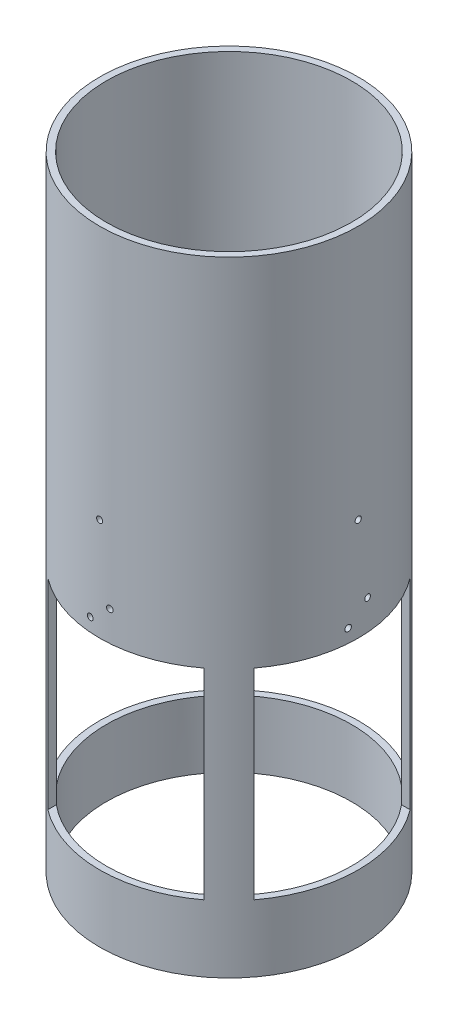
from build123d import *

# Parameters (mm, degrees)
SKETCH1_R           = 73.66
SKETCH1_R_2         = 69.85
BOSS_EXTRUDE1_DEPTH = 355.6
SKETCH4_W           = 88.9
SKETCH4_H           = 114.3
CUT_EXTRUDE1_DEPTH  = 76.2
CIRPATTERN1_COUNT   = 4
SKETCH5_R           = 1.7526
CUT_EXTRUDE2_DEPTH  = 76.2
CIRPATTERN2_COUNT   = 4


with BuildPart() as part:
    # Sketch1 → Boss-Extrude1 (new body)
    with BuildSketch(Plane(origin=(0, 0, 0), x_dir=(1, 0, 0), z_dir=(0, 1, 0))):
        with Locations(Location((0, 0, 0), (0, 0, 270))):
            Circle(SKETCH1_R)
        with Locations(Location((0, 0, 0), (0, 0, 270))):
            Circle(SKETCH1_R_2, mode=Mode.SUBTRACT)
    extrude(amount=BOSS_EXTRUDE1_DEPTH)

    # Sketch4 → Cut-Extrude1 (cut)
    with BuildSketch(Plane(origin=(73.66, 0, 0), x_dir=(0, 0, -1), z_dir=(1, 0, 0))):
        with Locations((0, 95.25)):
            Rectangle(SKETCH4_W, SKETCH4_H)
    cut_extrude1 = extrude(amount=-CUT_EXTRUDE1_DEPTH, mode=Mode.SUBTRACT)

    # CirPattern1: Cut-Extrude1 ×4 about axis
    cirpattern1_axis = Axis((0, 0, 0), (0, 1, 0))
    for i in range(1, CIRPATTERN1_COUNT):
        add(cut_extrude1.rotate(cirpattern1_axis, i * 360 / CIRPATTERN1_COUNT), mode=Mode.SUBTRACT)

    # Sketch5 → Cut-Extrude2 (cut)
    with BuildSketch(Plane(origin=(73.66, 0, 0), x_dir=(0, 0, -1), z_dir=(1, 0, 0))):
        with Locations((0, 210.82)):
            Circle(SKETCH5_R)
        with Locations((5.55625, 169.545)):
            Circle(SKETCH5_R)
        with Locations((-5.55625, 160.02)):
            Circle(SKETCH5_R)
    cut_extrude2 = extrude(amount=-CUT_EXTRUDE2_DEPTH, mode=Mode.SUBTRACT)

    # CirPattern2: Cut-Extrude2 ×4 about axis
    cirpattern2_axis = Axis((0, 355.6, 0), (0, -1, 0))
    for i in range(1, CIRPATTERN2_COUNT):
        add(cut_extrude2.rotate(cirpattern2_axis, i * 360 / CIRPATTERN2_COUNT), mode=Mode.SUBTRACT)


solid = part.part
